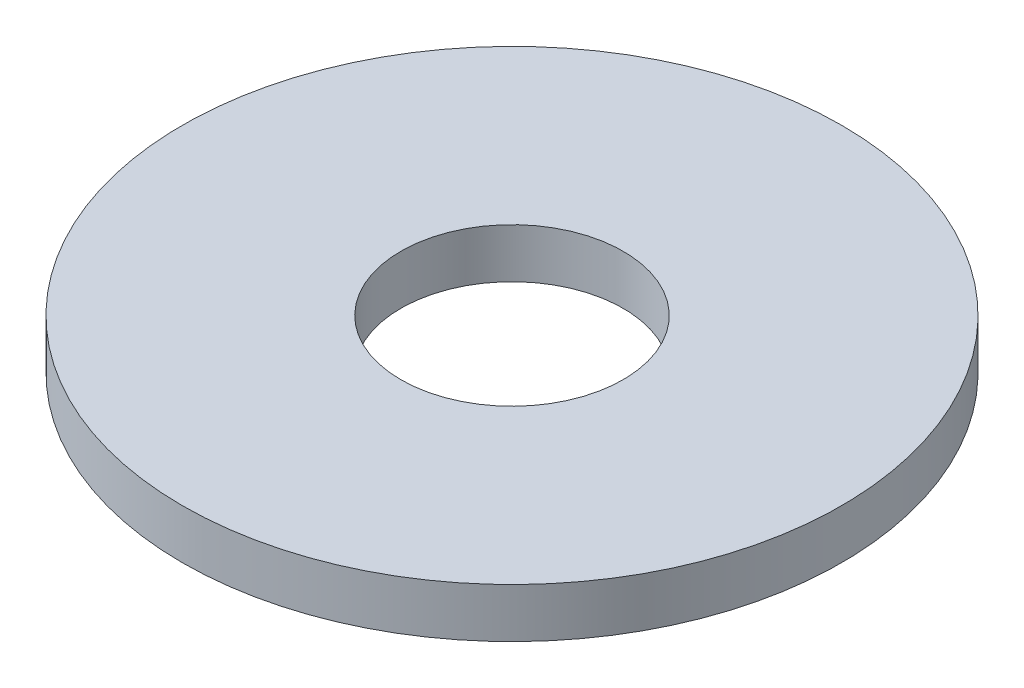
from build123d import *

# Parameters (mm, degrees)
SKETCH1_R           = 40
SKETCH1_R_2         = 13.5
BOSS_EXTRUDE1_DEPTH = 6


with BuildPart() as part:
    # Sketch1 → Boss-Extrude1 (new body)
    with BuildSketch(Plane(origin=(0, 0, 0), x_dir=(1, 0, 0), z_dir=(0, 1, 0))):
        with Locations(Location((0, 0, 0), (0, 0, 270))):
            Circle(SKETCH1_R)
        with Locations(Location((0, 0, 0), (0, 0, 270))):
            Circle(SKETCH1_R_2, mode=Mode.SUBTRACT)
    extrude(amount=BOSS_EXTRUDE1_DEPTH)


solid = part.part
